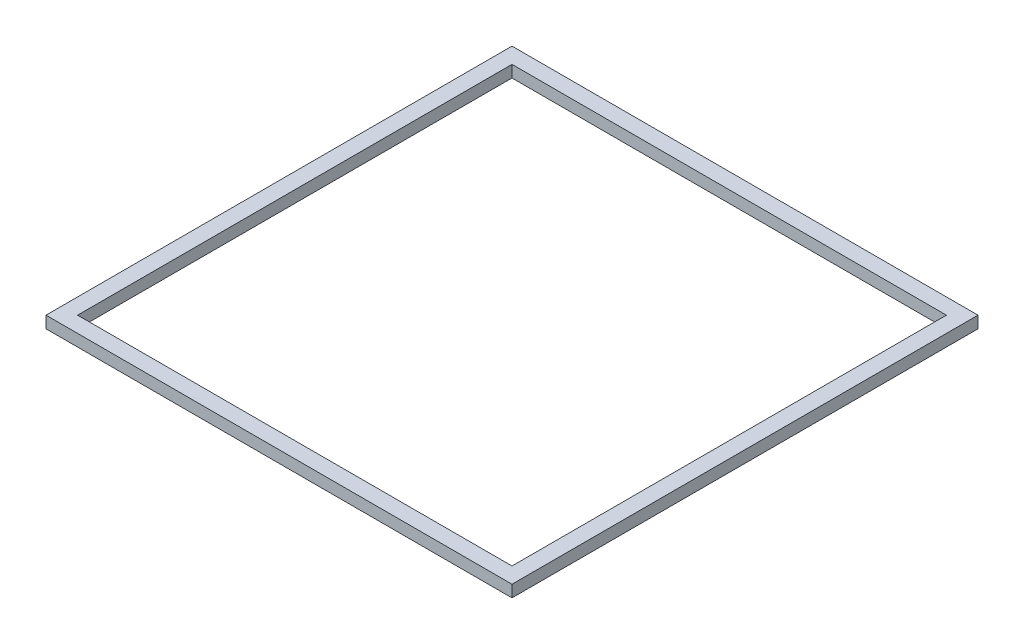
from build123d import *

# Parameters (mm, degrees)
ESBO_O1_W                = 5900
ESBO_O1_H                = 5900
ESBO_O1_W_2              = 5500
ESBO_O1_H_2              = 5500
RESSALTO_EXTRUS_O1_DEPTH = 150


with BuildPart() as part:
    # Esboço1 → Ressalto-extrusão1 (new body)
    with BuildSketch(Plane(origin=(0, 0, 0), x_dir=(1, 0, 0), z_dir=(0, 1, 0))):
        Rectangle(ESBO_O1_W, ESBO_O1_H)
        Rectangle(ESBO_O1_W_2, ESBO_O1_H_2, mode=Mode.SUBTRACT)
    extrude(amount=RESSALTO_EXTRUS_O1_DEPTH)


solid = part.part
